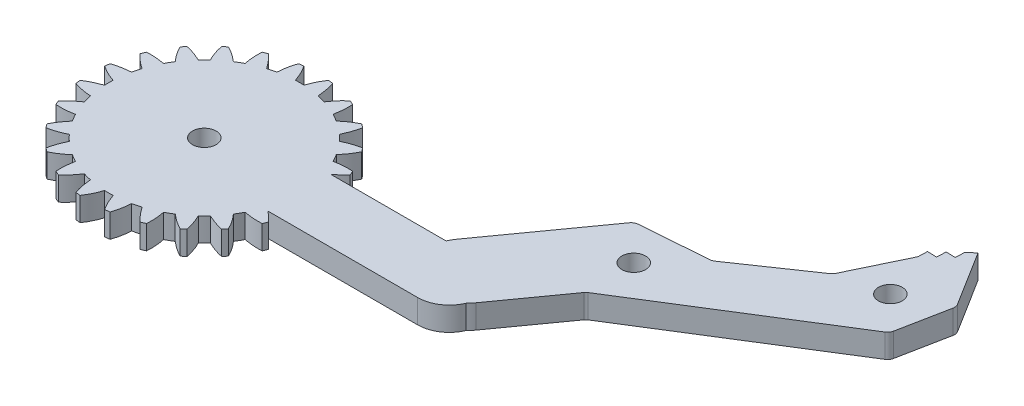
from build123d import *

# Parameters (mm, degrees)
SKETCH2_R           = 1.5
BOSS_EXTRUDE1_DEPTH = 3
SKETCH3_R           = 1.5
BOSS_EXTRUDE2_DEPTH = 3


with BuildPart() as part:
    # Sketch2 → Boss-Extrude1 (new body)
    with BuildSketch(Plane(origin=(0, 0, 0), x_dir=(1, 0, 0), z_dir=(0, 1, 0))):
        with BuildLine():
            Line((31, 4.000000001), (12.012859152, 4.000000001))
            add(Edge.make_bspline(
                [(13.278985865, 5.170206419), (12.8954662, 4.733530556), (12.462190225, 4.344528056), (12.012859152, 4.000000001)],
                knots=[0.154712813, 0.154712813, 0.154712813, 0.154712813, 0.777489596, 0.777489596, 0.777489596, 0.777489596], degree=3))
            ThreePointArc((13.278985865, 5.170206419), (13.165283338, 5.453238911), (13.045548971, 5.733772933))
            add(Edge.make_bspline(
                [(10.729735914, 5.571433139), (11.468148216, 5.731782959), (12.25282672, 5.797378255), (13.045548971, 5.733772933)],
                knots=[0, 0, 0, 0, 0.84522739, 0.84522739, 0.84522739, 0.84522739], degree=3))
            ThreePointArc((10.729735914, 5.571433139), (10.602635836, 5.809665509), (10.470247132, 6.045))
            ThreePointArc((10.470247132, 6.045), (10.332600838, 6.277376835), (10.189798038, 6.506620931))
            add(Edge.make_bspline(
                [(11.488367505, 8.430890348), (11.138958904, 7.723663869), (10.678280228, 7.077546079), (10.189798038, 6.506620931)],
                knots=[0.154712813, 0.154712813, 0.154712813, 0.154712813, 1, 1, 1, 1], degree=3))
            ThreePointArc((11.488367505, 8.430890348), (11.305285099, 8.674850363), (11.117023034, 8.914835886))
            add(Edge.make_bspline(
                [(8.922136024, 8.158651162), (9.593885949, 8.504652361), (10.334849869, 8.771102293), (11.117023034, 8.914835886)],
                knots=[0, 0, 0, 0, 0.84522739, 0.84522739, 0.84522739, 0.84522739], degree=3))
            ThreePointArc((8.922136024, 8.158651162), (8.737707702, 8.35587004), (8.548920985, 8.548920985))
            ThreePointArc((8.548920985, 8.548920985), (8.355821324, 8.737754288), (8.158551674, 8.922226997))
            add(Edge.make_bspline(
                [(8.914835886, 11.117023034), (8.760376776, 10.343461111), (8.482622935, 9.600126837), (8.158551674, 8.922226997)],
                knots=[0.154712813, 0.154712813, 0.154712813, 0.154712813, 1, 1, 1, 1], degree=3))
            ThreePointArc((8.914835886, 11.117023034), (8.674850363, 11.305285099), (8.430890348, 11.488367505))
            add(Edge.make_bspline(
                [(6.506507308, 10.189870591), (7.065816209, 10.697943759), (7.71257008, 11.147090204), (8.430890348, 11.488367505)],
                knots=[0, 0, 0, 0, 0.84522739, 0.84522739, 0.84522739, 0.84522739], degree=3))
            ThreePointArc((6.506507308, 10.189870591), (6.277319227, 10.332635836), (6.045, 10.470247132))
            ThreePointArc((6.045, 10.470247132), (5.809606396, 10.602668227), (5.571313495, 10.729798038))
            add(Edge.make_bspline(
                [(5.733772933, 13.045548971), (5.784789448, 12.258368573), (5.708888907, 11.468474815), (5.571313495, 10.729798038)],
                knots=[0.154712813, 0.154712813, 0.154712813, 0.154712813, 1, 1, 1, 1], degree=3))
            ThreePointArc((5.733772933, 13.045548971), (5.453238911, 13.165283338), (5.170206419, 13.278985865))
            add(Edge.make_bspline(
                [(3.647470872, 11.526667178), (4.056222772, 12.16218797), (4.564691385, 12.76342234), (5.170206419, 13.278985865)],
                knots=[0, 0, 0, 0, 0.84522739, 0.84522739, 0.84522739, 0.84522739], degree=3))
            ThreePointArc((3.647470872, 11.526667178), (3.389141821, 11.605249576), (3.129122255, 11.67804324))
            ThreePointArc((3.129122255, 11.67804324), (2.867476392, 11.745027848), (2.604399509, 11.806151075))
            add(Edge.make_bspline(
                [(2.161962831, 14.085042304), (2.414978279, 13.337888473), (2.546103534, 12.555265188), (2.604399509, 11.806151075)],
                knots=[0.154712813, 0.154712813, 0.154712813, 0.154712813, 1, 1, 1, 1], degree=3))
            ThreePointArc((2.161962831, 14.085042304), (1.859998239, 14.128089275), (1.557181466, 14.164663282))
            add(Edge.make_bspline(
                [(0.539865323, 12.077940447), (0.770204456, 12.797599169), (1.105736515, 13.509948335), (1.557181466, 14.164663282)],
                knots=[0, 0, 0, 0, 0.84522739, 0.84522739, 0.84522739, 0.84522739], degree=3))
            ThreePointArc((0.539865323, 12.077940447), (0.27, 12.086984736), (0, 12.09))
            ThreePointArc((0, 12.09), (-0.270067389, 12.08698323), (-0.54, 12.077934426))
            add(Edge.make_bspline(
                [(-1.557181466, 14.164663282), (-1.119409669, 13.508453317), (-0.790194587, 12.786434986), (-0.54, 12.077934426)],
                knots=[0.154712813, 0.154712813, 0.154712813, 0.154712813, 1, 1, 1, 1], degree=3))
            ThreePointArc((-1.557181466, 14.164663282), (-1.859998239, 14.128089275), (-2.161962831, 14.085042304))
            add(Edge.make_bspline(
                [(-2.604531155, 11.806122033), (-2.568302021, 12.560875133), (-2.42857247, 13.335793678), (-2.161962831, 14.085042304)],
                knots=[0, 0, 0, 0, 0.84522739, 0.84522739, 0.84522739, 0.84522739], degree=3))
            ThreePointArc((-2.604531155, 11.806122033), (-2.867541874, 11.74501186), (-3.129122255, 11.67804324))
            ThreePointArc((-3.129122255, 11.67804324), (-3.389206524, 11.60523068), (-3.647599401, 11.526626506))
            add(Edge.make_bspline(
                [(-5.170206419, 13.278985865), (-4.577511698, 12.75843939), (-4.072642252, 12.146230371), (-3.647599401, 11.526626506)],
                knots=[0.154712813, 0.154712813, 0.154712813, 0.154712813, 1, 1, 1, 1], degree=3))
            ThreePointArc((-5.170206419, 13.278985865), (-5.453238911, 13.165283338), (-5.733772933, 13.045548971))
            add(Edge.make_bspline(
                [(-5.571433139, 10.729735914), (-5.731782959, 11.468148216), (-5.797378255, 12.25282672), (-5.733772933, 13.045548971)],
                knots=[0, 0, 0, 0, 0.84522739, 0.84522739, 0.84522739, 0.84522739], degree=3))
            ThreePointArc((-5.571433139, 10.729735914), (-5.809665509, 10.602635836), (-6.045, 10.470247132))
            ThreePointArc((-6.045, 10.470247132), (-6.277376835, 10.332600838), (-6.506620931, 10.189798038))
            add(Edge.make_bspline(
                [(-8.430890348, 11.488367505), (-7.723663869, 11.138958904), (-7.077546079, 10.678280228), (-6.506620931, 10.189798038)],
                knots=[0.154712813, 0.154712813, 0.154712813, 0.154712813, 1, 1, 1, 1], degree=3))
            ThreePointArc((-8.430890348, 11.488367505), (-8.674850363, 11.305285099), (-8.914835886, 11.117023034))
            add(Edge.make_bspline(
                [(-8.158651162, 8.922136024), (-8.504652361, 9.593885949), (-8.771102293, 10.334849869), (-8.914835886, 11.117023034)],
                knots=[0, 0, 0, 0, 0.84522739, 0.84522739, 0.84522739, 0.84522739], degree=3))
            ThreePointArc((-8.158651162, 8.922136024), (-8.35587004, 8.737707702), (-8.548920985, 8.548920985))
            ThreePointArc((-8.548920985, 8.548920985), (-8.737754288, 8.355821324), (-8.922226997, 8.158551674))
            add(Edge.make_bspline(
                [(-11.117023034, 8.914835886), (-10.343461111, 8.760376776), (-9.600126837, 8.482622935), (-8.922226997, 8.158551674)],
                knots=[0.154712813, 0.154712813, 0.154712813, 0.154712813, 1, 1, 1, 1], degree=3))
            ThreePointArc((-11.117023034, 8.914835886), (-11.305285099, 8.674850363), (-11.488367505, 8.430890348))
            add(Edge.make_bspline(
                [(-10.189870591, 6.506507308), (-10.697943759, 7.065816209), (-11.147090204, 7.71257008), (-11.488367505, 8.430890348)],
                knots=[0, 0, 0, 0, 0.84522739, 0.84522739, 0.84522739, 0.84522739], degree=3))
            ThreePointArc((-10.189870591, 6.506507308), (-10.332635836, 6.277319227), (-10.470247132, 6.045))
            ThreePointArc((-10.470247132, 6.045), (-10.602668227, 5.809606396), (-10.729798038, 5.571313495))
            add(Edge.make_bspline(
                [(-13.045548971, 5.733772933), (-12.258368573, 5.784789448), (-11.468474815, 5.708888907), (-10.729798038, 5.571313495)],
                knots=[0.154712813, 0.154712813, 0.154712813, 0.154712813, 1, 1, 1, 1], degree=3))
            ThreePointArc((-13.045548971, 5.733772933), (-13.165283338, 5.453238911), (-13.278985865, 5.170206419))
            add(Edge.make_bspline(
                [(-11.526667178, 3.647470872), (-12.16218797, 4.056222772), (-12.76342234, 4.564691385), (-13.278985865, 5.170206419)],
                knots=[0, 0, 0, 0, 0.84522739, 0.84522739, 0.84522739, 0.84522739], degree=3))
            ThreePointArc((-11.526667178, 3.647470872), (-11.605249576, 3.389141821), (-11.67804324, 3.129122255))
            ThreePointArc((-11.67804324, 3.129122255), (-11.745027848, 2.867476392), (-11.806151075, 2.604399509))
            add(Edge.make_bspline(
                [(-14.085042304, 2.161962831), (-13.337888473, 2.414978279), (-12.555265188, 2.546103534), (-11.806151075, 2.604399509)],
                knots=[0.154712813, 0.154712813, 0.154712813, 0.154712813, 1, 1, 1, 1], degree=3))
            ThreePointArc((-14.085042304, 2.161962831), (-14.128089275, 1.859998239), (-14.164663282, 1.557181466))
            add(Edge.make_bspline(
                [(-12.077940447, 0.539865323), (-12.797599169, 0.770204456), (-13.509948335, 1.105736515), (-14.164663282, 1.557181466)],
                knots=[0, 0, 0, 0, 0.84522739, 0.84522739, 0.84522739, 0.84522739], degree=3))
            ThreePointArc((-12.077940447, 0.539865323), (-12.086984736, 0.27), (-12.09, 0))
            ThreePointArc((-12.09, 0), (-12.08698323, -0.270067389), (-12.077934426, -0.54))
            add(Edge.make_bspline(
                [(-14.164663282, -1.557181466), (-13.508453317, -1.119409669), (-12.786434986, -0.790194587), (-12.077934426, -0.54)],
                knots=[0.154712813, 0.154712813, 0.154712813, 0.154712813, 1, 1, 1, 1], degree=3))
            ThreePointArc((-14.164663282, -1.557181466), (-14.128089275, -1.859998239), (-14.085042304, -2.161962831))
            add(Edge.make_bspline(
                [(-11.806122033, -2.604531155), (-12.560875133, -2.568302021), (-13.335793678, -2.42857247), (-14.085042304, -2.161962831)],
                knots=[0, 0, 0, 0, 0.84522739, 0.84522739, 0.84522739, 0.84522739], degree=3))
            ThreePointArc((-11.806122033, -2.604531155), (-11.74501186, -2.867541874), (-11.67804324, -3.129122255))
            ThreePointArc((-11.67804324, -3.129122255), (-11.60523068, -3.389206524), (-11.526626506, -3.647599401))
            add(Edge.make_bspline(
                [(-13.278985865, -5.170206419), (-12.75843939, -4.577511698), (-12.146230371, -4.072642252), (-11.526626506, -3.647599401)],
                knots=[0.154712813, 0.154712813, 0.154712813, 0.154712813, 1, 1, 1, 1], degree=3))
            ThreePointArc((-13.278985865, -5.170206419), (-13.165283338, -5.453238911), (-13.045548971, -5.733772933))
            add(Edge.make_bspline(
                [(-10.729735914, -5.571433139), (-11.468148216, -5.731782959), (-12.25282672, -5.797378255), (-13.045548971, -5.733772933)],
                knots=[0, 0, 0, 0, 0.84522739, 0.84522739, 0.84522739, 0.84522739], degree=3))
            ThreePointArc((-10.729735914, -5.571433139), (-10.602635836, -5.809665509), (-10.470247132, -6.045))
            ThreePointArc((-10.470247132, -6.045), (-10.332600838, -6.277376835), (-10.189798038, -6.506620931))
            add(Edge.make_bspline(
                [(-11.488367505, -8.430890348), (-11.138958904, -7.723663869), (-10.678280228, -7.077546079), (-10.189798038, -6.506620931)],
                knots=[0.154712813, 0.154712813, 0.154712813, 0.154712813, 1, 1, 1, 1], degree=3))
            ThreePointArc((-11.488367505, -8.430890348), (-11.305285099, -8.674850363), (-11.117023034, -8.914835886))
            add(Edge.make_bspline(
                [(-8.922136024, -8.158651162), (-9.593885949, -8.504652361), (-10.334849869, -8.771102293), (-11.117023034, -8.914835886)],
                knots=[0, 0, 0, 0, 0.84522739, 0.84522739, 0.84522739, 0.84522739], degree=3))
            ThreePointArc((-8.922136024, -8.158651162), (-8.737707702, -8.35587004), (-8.548920985, -8.548920985))
            ThreePointArc((-8.548920985, -8.548920985), (-8.355821324, -8.737754288), (-8.158551674, -8.922226997))
            add(Edge.make_bspline(
                [(-8.914835886, -11.117023034), (-8.760376776, -10.343461111), (-8.482622935, -9.600126837), (-8.158551674, -8.922226997)],
                knots=[0.154712813, 0.154712813, 0.154712813, 0.154712813, 1, 1, 1, 1], degree=3))
            ThreePointArc((-8.914835886, -11.117023034), (-8.674850363, -11.305285099), (-8.430890348, -11.488367505))
            add(Edge.make_bspline(
                [(-6.506507308, -10.189870591), (-7.065816209, -10.697943759), (-7.71257008, -11.147090204), (-8.430890348, -11.488367505)],
                knots=[0, 0, 0, 0, 0.84522739, 0.84522739, 0.84522739, 0.84522739], degree=3))
            ThreePointArc((-6.506507308, -10.189870591), (-6.277319227, -10.332635836), (-6.045, -10.470247132))
            ThreePointArc((-6.045, -10.470247132), (-5.809606396, -10.602668227), (-5.571313495, -10.729798038))
            add(Edge.make_bspline(
                [(-5.733772933, -13.045548971), (-5.784789448, -12.258368573), (-5.708888907, -11.468474815), (-5.571313495, -10.729798038)],
                knots=[0.154712813, 0.154712813, 0.154712813, 0.154712813, 1, 1, 1, 1], degree=3))
            ThreePointArc((-5.733772933, -13.045548971), (-5.453238911, -13.165283338), (-5.170206419, -13.278985865))
            add(Edge.make_bspline(
                [(-3.647470872, -11.526667178), (-4.056222772, -12.16218797), (-4.564691385, -12.76342234), (-5.170206419, -13.278985865)],
                knots=[0, 0, 0, 0, 0.84522739, 0.84522739, 0.84522739, 0.84522739], degree=3))
            ThreePointArc((-3.647470872, -11.526667178), (-3.389141821, -11.605249576), (-3.129122255, -11.67804324))
            ThreePointArc((-3.129122255, -11.67804324), (-2.867476392, -11.745027848), (-2.604399509, -11.806151075))
            add(Edge.make_bspline(
                [(-2.161962831, -14.085042304), (-2.414978279, -13.337888473), (-2.546103534, -12.555265188), (-2.604399509, -11.806151075)],
                knots=[0.154712813, 0.154712813, 0.154712813, 0.154712813, 1, 1, 1, 1], degree=3))
            ThreePointArc((-2.161962831, -14.085042304), (-1.859998239, -14.128089275), (-1.557181466, -14.164663282))
            add(Edge.make_bspline(
                [(-0.539865323, -12.077940447), (-0.770204456, -12.797599169), (-1.105736515, -13.509948335), (-1.557181466, -14.164663282)],
                knots=[0, 0, 0, 0, 0.84522739, 0.84522739, 0.84522739, 0.84522739], degree=3))
            ThreePointArc((-0.539865323, -12.077940447), (-0.27, -12.086984736), (0, -12.09))
            ThreePointArc((0, -12.09), (0.270067389, -12.08698323), (0.54, -12.077934426))
            add(Edge.make_bspline(
                [(1.557181466, -14.164663282), (1.119409669, -13.508453317), (0.790194587, -12.786434986), (0.54, -12.077934426)],
                knots=[0.154712813, 0.154712813, 0.154712813, 0.154712813, 1, 1, 1, 1], degree=3))
            ThreePointArc((1.557181466, -14.164663282), (1.859998239, -14.128089275), (2.161962831, -14.085042304))
            add(Edge.make_bspline(
                [(2.604531155, -11.806122033), (2.568302021, -12.560875133), (2.42857247, -13.335793678), (2.161962831, -14.085042304)],
                knots=[0, 0, 0, 0, 0.84522739, 0.84522739, 0.84522739, 0.84522739], degree=3))
            ThreePointArc((2.604531155, -11.806122033), (2.867541874, -11.74501186), (3.129122255, -11.67804324))
            ThreePointArc((3.129122255, -11.67804324), (3.389206524, -11.60523068), (3.647599401, -11.526626506))
            add(Edge.make_bspline(
                [(5.170206419, -13.278985865), (4.577511698, -12.75843939), (4.072642252, -12.146230371), (3.647599401, -11.526626506)],
                knots=[0.154712813, 0.154712813, 0.154712813, 0.154712813, 1, 1, 1, 1], degree=3))
            ThreePointArc((5.170206419, -13.278985865), (5.453238911, -13.165283338), (5.733772933, -13.045548971))
            add(Edge.make_bspline(
                [(5.571433139, -10.729735914), (5.731782959, -11.468148216), (5.797378255, -12.25282672), (5.733772933, -13.045548971)],
                knots=[0, 0, 0, 0, 0.84522739, 0.84522739, 0.84522739, 0.84522739], degree=3))
            ThreePointArc((5.571433139, -10.729735914), (5.809665509, -10.602635836), (6.045, -10.470247132))
            ThreePointArc((6.045, -10.470247132), (6.277376835, -10.332600838), (6.506620931, -10.189798038))
            add(Edge.make_bspline(
                [(8.430890348, -11.488367505), (7.723663869, -11.138958904), (7.077546079, -10.678280228), (6.506620931, -10.189798038)],
                knots=[0.154712813, 0.154712813, 0.154712813, 0.154712813, 1, 1, 1, 1], degree=3))
            ThreePointArc((8.430890348, -11.488367505), (8.674850363, -11.305285099), (8.914835886, -11.117023034))
            add(Edge.make_bspline(
                [(8.158651162, -8.922136024), (8.504652361, -9.593885949), (8.771102293, -10.334849869), (8.914835886, -11.117023034)],
                knots=[0, 0, 0, 0, 0.84522739, 0.84522739, 0.84522739, 0.84522739], degree=3))
            ThreePointArc((8.158651162, -8.922136024), (8.35587004, -8.737707702), (8.548920985, -8.548920985))
            ThreePointArc((8.548920985, -8.548920985), (8.737754288, -8.355821324), (8.922226997, -8.158551674))
            add(Edge.make_bspline(
                [(11.117023034, -8.914835886), (10.343461111, -8.760376776), (9.600126837, -8.482622935), (8.922226997, -8.158551674)],
                knots=[0.154712813, 0.154712813, 0.154712813, 0.154712813, 1, 1, 1, 1], degree=3))
            ThreePointArc((11.117023034, -8.914835886), (11.305285099, -8.674850363), (11.488367505, -8.430890348))
            add(Edge.make_bspline(
                [(10.189870591, -6.506507308), (10.697943759, -7.065816209), (11.147090204, -7.71257008), (11.488367505, -8.430890348)],
                knots=[0, 0, 0, 0, 0.84522739, 0.84522739, 0.84522739, 0.84522739], degree=3))
            ThreePointArc((10.189870591, -6.506507308), (10.332635836, -6.277319227), (10.470247132, -6.045))
            ThreePointArc((10.470247132, -6.045), (10.602668227, -5.809606396), (10.729798038, -5.571313495))
            add(Edge.make_bspline(
                [(13.045548971, -5.733772933), (12.258368573, -5.784789448), (11.468474815, -5.708888907), (10.729798038, -5.571313495)],
                knots=[0.154712813, 0.154712813, 0.154712813, 0.154712813, 1, 1, 1, 1], degree=3))
            ThreePointArc((13.045548971, -5.733772933), (13.165283338, -5.453238911), (13.278985865, -5.170206419))
            add(Edge.make_bspline(
                [(12.032510858, -3.999999999), (12.480346232, -4.337627374), (12.902507267, -4.728042767), (13.278985865, -5.170206419)],
                knots=[0.228019214, 0.228019214, 0.228019214, 0.228019214, 0.84522739, 0.84522739, 0.84522739, 0.84522739], degree=3))
            Line((12.032510858, -3.999999999), (31, -3.999999999))
            ThreePointArc((31, -3.999999999), (35, 1e-09), (31, 4.000000001))
        make_face()
        with Locations(Location((31, 1e-09, 0), (0, 0, 270))):
            Circle(SKETCH2_R, mode=Mode.SUBTRACT)
        with Locations(Location((0, 0, 0), (0, 0, 270))):
            Circle(SKETCH2_R, mode=Mode.SUBTRACT)
    extrude(amount=BOSS_EXTRUDE1_DEPTH)

    # Sketch3 → Boss-Extrude2 (add)
    with BuildSketch(Plane(origin=(0, 3, 0), x_dir=(1, 0, 0), z_dir=(0, 1, 0))):
        with BuildLine():
            Line((45.342620958, 18.63332708), (36.924773557, 17.991233454))
            ThreePointArc((36.924773557, 17.991233454), (36.510376955, 17.865597429), (36.187944742, 17.57655345))
            Line((36.187944742, 17.57655345), (27.123277422, 4.92504297))
            ThreePointArc((27.123277422, 4.92504297), (28.275587613, -2.051502107), (35.252132691, -0.899191916))
            Line((35.252132691, -0.899191916), (40.961308692, 7.069076246))
            ThreePointArc((40.961308692, 7.069076246), (41.089598501, 7.215575732), (41.243848437, 7.334434186))
            Line((41.243848437, 7.334434186), (64.340156854, 21.782768792))
            ThreePointArc((64.340156854, 21.782768792), (64.633430993, 22.063408065), (64.790998824, 22.437494286))
            Line((64.790998824, 22.437494286), (66.022951024, 28.698769849))
            ThreePointArc((66.022951024, 28.698769849), (66.025180568, 29.073182951), (65.889544701, 29.422171567))
            Line((65.889544701, 29.422171567), (61.564852895, 36.335384645))
            Line((61.564852895, 36.335384645), (60.663867904, 35.573396425))
            Line((60.663867904, 35.573396425), (60.620310055, 34.394200634))
            Line((60.620310055, 34.394200634), (59.441114264, 34.437758484))
            Line((59.441114264, 34.437758484), (59.397556414, 33.258562693))
            Line((59.397556414, 33.258562693), (58.218360623, 33.302120542))
            Line((58.218360623, 33.302120542), (58.174802773, 32.122924751))
            Line((58.174802773, 32.122924751), (54.806106143, 25.103881461))
            ThreePointArc((54.806106143, 25.103881461), (54.66339969, 24.885287738), (54.468979623, 24.711077563))
            Line((54.468979623, 24.711077563), (45.830983037, 18.804941974))
            ThreePointArc((45.830983037, 18.804941974), (45.598098762, 18.686987483), (45.342620958, 18.63332708))
        make_face()
        with Locations(Location((40.859536964, 13.478337318, 0), (0, 0, 270))):
            Circle(SKETCH3_R, mode=Mode.SUBTRACT)
        with Locations(Location((60.523879809, 26.282966133, 0), (0, 0, 270))):
            Circle(SKETCH3_R, mode=Mode.SUBTRACT)
    extrude(amount=-BOSS_EXTRUDE2_DEPTH)


solid = part.part
